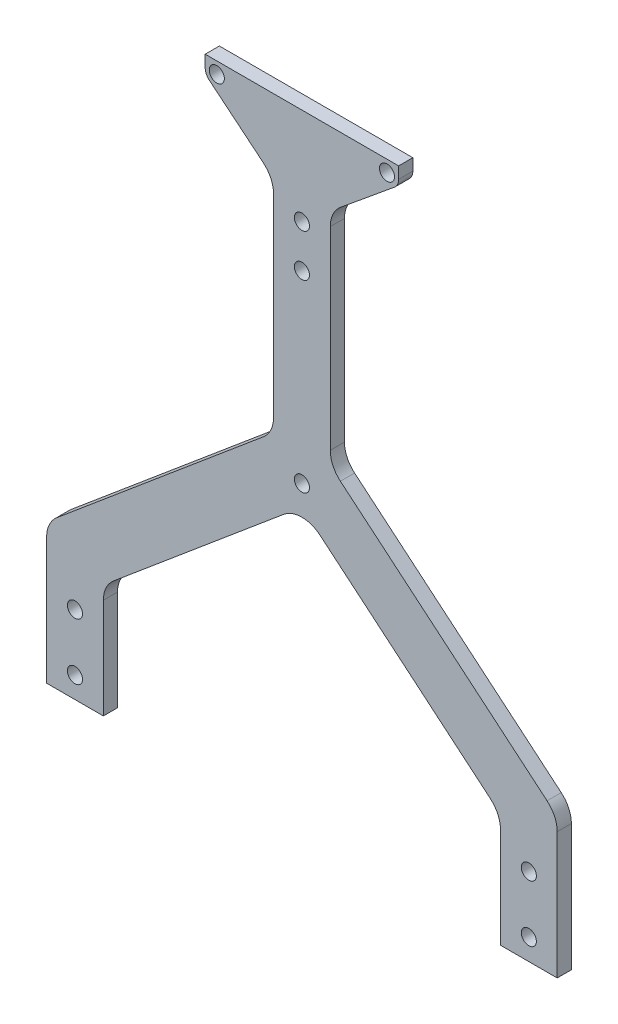
from build123d import *

# Parameters (mm, degrees)
BOSS_EXTRUDE1_DEPTH     = 3.175
FILLET1_R               = 12.7
F_1_4_CLEARANCE_HOLE1_D = 6.7564
F_1_4_CLEARANCE_HOLE3_D = 6.7564
F_1_4_CLEARANCE_HOLE4_D = 6.7564
SKETCH11_R              = 3.3782
BOSS_EXTRUDE2_DEPTH     = 6.35
FILLET2_R               = 12.7
SKETCH12_R              = 3.3782
CUT_EXTRUDE1_DEPTH      = 302.94233307


with BuildPart() as part:
    # Sketch1 → Boss-Extrude1 (new, symmetric)
    with BuildSketch(Plane.XY):
        Polygon((-88.9, 0), (-114.3, 0), (-114.3, 62.644214517), (-41.726805286, 123.540355435), (-12.7, 147.896737045), (-12.7, 279.4), (12.7, 279.4), (12.7, 147.896737045), (41.726805286, 123.540355435), (114.3, 62.644214517), (114.3, 0), (88.9, 0), (88.9, 50.8), (25.4, 104.08282658), (0, 125.395957212), (-25.4, 104.08282658), (-88.9, 50.8), align=None)
    extrude(amount=BOSS_EXTRUDE1_DEPTH, both=True)

    # Fillet1
    fillet1_edges = [part.edges().sort_by_distance(p)[0] for p in [
        (-114.3, 62.644214517, 0),
        (-12.7, 147.896737045, 0),
        (12.7, 147.896737045, 0),
        (114.3, 62.644214517, 0),
        (88.9, 50.8, 0),
        (0, 125.395957212, 0),
        (-88.9, 50.8, 0),
    ]]
    fillet(fillet1_edges, radius=FILLET1_R)

    # 1/4 Clearance Hole1 (through all)
    with Locations(Plane.XY.offset(3.175)):
        with Locations((101.6, 34.925), (-101.6, 9.525), (-101.6, 34.925), (101.6, 9.525)):
            Hole(F_1_4_CLEARANCE_HOLE1_D / 2)

    # 1/4 Clearance Hole3 (through all)
    with Locations(Plane(origin=(0, 0, -3.175), x_dir=(-1, 0, 0), z_dir=(0, 0, -1))):
        with Locations((0, 134.62)):
            Hole(F_1_4_CLEARANCE_HOLE3_D / 2)

    # 1/4 Clearance Hole4 (through all)
    with Locations(Plane.XY.offset(3.175)):
        with Locations((0, 217.046839415)):
            Hole(F_1_4_CLEARANCE_HOLE4_D / 2)

    # Sketch11 → Boss-Extrude2 (add)
    with BuildSketch(Plane.XY.offset(3.175)):
        with BuildLine():
            Line((-43.303160585, 279.4), (43.303160585, 279.4))
            Line((43.303160585, 279.4), (43.303160585, 274.196839415))
            ThreePointArc((43.303160585, 274.196839415), (42.805221287, 271.975629672), (41.406708366, 270.179556768))
            Line((41.406708366, 270.179556768), (2.60825781, 238.24375032))
            ThreePointArc((2.60825781, 238.24375032), (0, 239.475039415), (-2.60825781, 238.24375032))
            Line((-2.60825781, 238.24375032), (-41.406708366, 270.179556768))
            ThreePointArc((-41.406708366, 270.179556768), (-42.805221287, 271.975629672), (-43.303160585, 274.196839415))
            Line((-43.303160585, 274.196839415), (-43.303160585, 279.4))
        make_face()
        with Locations((-38.1, 274.196839415)):
            Circle(SKETCH11_R, mode=Mode.SUBTRACT)
        with Locations((38.1, 274.196839415)):
            Circle(SKETCH11_R, mode=Mode.SUBTRACT)
    extrude(amount=-BOSS_EXTRUDE2_DEPTH)

    # Fillet2
    fillet2_edges = [part.edges().sort_by_distance(p)[0] for p in [
        (12.7, 246.550471869, 0),
        (-12.7, 246.550471869, 0),
    ]]
    fillet(fillet2_edges, radius=FILLET2_R)

    # Sketch12 → Cut-Extrude1 (cut, through all)
    with BuildSketch(Plane.XY.offset(3.175)):
        with Locations((0, 236.096839415)):
            Circle(SKETCH12_R)
    extrude(amount=-CUT_EXTRUDE1_DEPTH, mode=Mode.SUBTRACT)


solid = part.part
